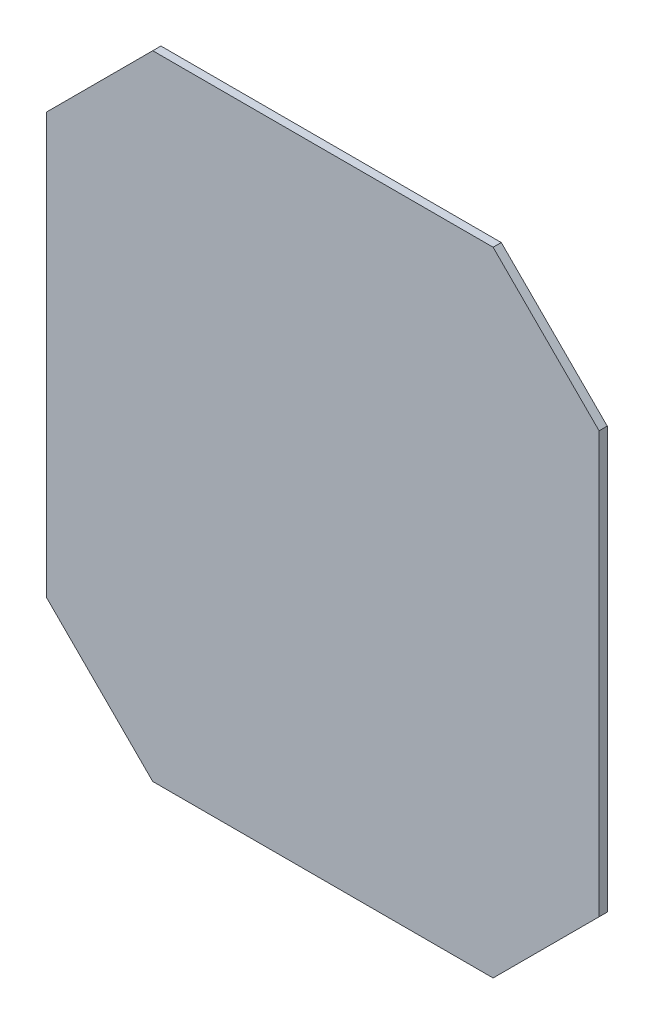
from build123d import *

# Parameters (mm, degrees)
BOSS_EXTRUDE1_DEPTH = 4
SKETCH2_W           = 429.121378383
SKETCH2_H           = 424.720133477
CUT_EXTRUDE1_DEPTH  = 10


with BuildPart() as part:
    # Sketch1 → Boss-Extrude1 (new body)
    with BuildSketch(Plane.XY):
        Polygon((88.868642116, -197.391367321), (-88.868642116, -197.391367321), (-88.868642116, -217.665581629), (-129.454428553, -258.251368066), (-150.131357884, -258.251368066), (-150.131357884, -476.251366576), (-129.454428553, -476.251366576), (-88.868642116, -516.837153014), (-88.868642116, -537.111367321), (88.868642116, -537.111367321), (88.868642116, -516.837153014), (129.454428553, -476.251366576), (150.131357884, -476.251366576), (150.131357884, -258.251368066), (129.454428553, -258.251368066), (88.868642116, -217.665581629), align=None)
    extrude(amount=BOSS_EXTRUDE1_DEPTH)

    # Sketch2 → Cut-Extrude1 (cut)
    with BuildSketch(Plane.XY.offset(4)):
        with Locations((25.344127001, -373.74675893)):
            Rectangle(SKETCH2_W, SKETCH2_H)
        Polygon((-83.394427808, -212.191367321), (83.394427808, -212.191367321), (135.331357884, -264.128297397), (135.331357884, -470.374437245), (83.394427808, -522.311367321), (-83.394427808, -522.311367321), (-135.331357884, -470.374437245), (-135.331357884, -264.128297397), align=None, mode=Mode.SUBTRACT)
    extrude(amount=-CUT_EXTRUDE1_DEPTH, mode=Mode.SUBTRACT)


solid = part.part
